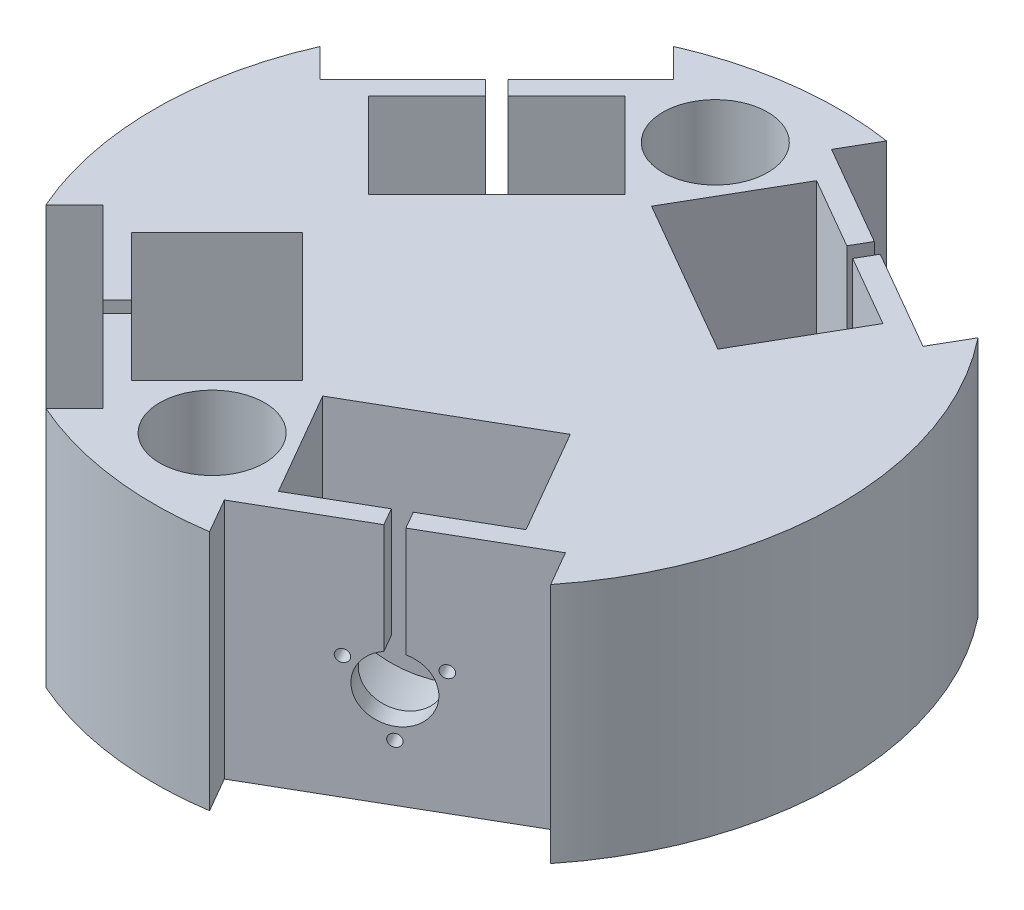
from build123d import *

# Parameters (mm, degrees)
BASE_DEPTH                = 60
MOTOR_TRASEIRO_START      = -5
MOTOR_TRASEIRO_DEPTH      = 30
ESBO_O3_10_R              = 1.5
MOTOR_EIXO_DEPTH          = 25
PADR_OCIRCULAR1_COUNT     = 2
PADR_OCIRCULAR1_ANGLE     = 285
ESPELHAR3_START           = -5
ESPELHAR3_COPY_1_DEPTH    = 30
ESPELHAR3_COPY_2_SKETCH_R = 1.5
ESPELHAR3_COPY_2_DEPTH    = 25
ESBO_O16_R                = 13
CAPACITORES_DEPTH         = 45


with BuildPart() as part:
    # Esboço1 → Base (new body)
    with BuildSketch(Plane(origin=(0, 0, 0), x_dir=(1, 0, 0), z_dir=(0, 1, 0))):
        with BuildLine():
            Line((-70.813516723, -26.97289629), (-26.97289629, -70.813516723))
            Line((-26.97289629, -70.813516723), (-34.043964102, -77.884584535))
            ThreePointArc((-34.043964102, -77.884584535), (-11.094726339, -84.272813217), (12.725930358, -84.041957953))
            Line((12.725930358, -84.041957953), (7.725930358, -75.381703915))
            Line((7.725930358, -75.381703915), (61.419505392, -44.381703915))
            Line((61.419505392, -44.381703915), (66.419505392, -53.041957953))
            ThreePointArc((66.419505392, -53.041957953), (85, 0), (66.419505392, 53.041957953))
            Line((66.419505392, 53.041957953), (61.419505392, 44.381703915))
            Line((61.419505392, 44.381703915), (7.725930358, 75.381703915))
            Line((7.725930358, 75.381703915), (12.725930358, 84.041957953))
            ThreePointArc((12.725930358, 84.041957953), (-11.094726339, 84.272813217), (-34.043964102, 77.884584535))
            Line((-34.043964102, 77.884584535), (-26.97289629, 70.813516723))
            Line((-26.97289629, 70.813516723), (-70.813516723, 26.97289629))
            Line((-70.813516723, 26.97289629), (-77.884584535, 34.043964102))
            ThreePointArc((-77.884584535, 34.043964102), (-85, 0), (-77.884584535, -34.043964102))
            Line((-77.884584535, -34.043964102), (-70.813516723, -26.97289629))
        make_face()
    extrude(amount=BASE_DEPTH)

    # Esboço3 → Motor-traseiro (cut)
    with BuildSketch(Plane(origin=(-48.893206507, 0, 48.893206507), x_dir=(0.7071067811865515, 0, 0.7071067811865436), z_dir=(-0.7071067811865436, 0, 0.7071067811865515)).offset(MOTOR_TRASEIRO_START)):
        with BuildLine():
            ThreePointArc((-22.5, 25), (0, 2.5), (22.5, 25))
            Line((22.5, 25), (22.5, 80))
            Line((22.5, 80), (-22.5, 80))
            Line((-22.5, 80), (-22.5, 25))
        make_face()
    motor_traseiro = extrude(amount=-MOTOR_TRASEIRO_DEPTH, mode=Mode.SUBTRACT)

    # Esboço3<10> → Motor-eixo (cut)
    with BuildSketch(Plane(origin=(-48.893206507, 0, 48.893206507), x_dir=(0.7071067811865515, 0, 0.7071067811865436), z_dir=(-0.7071067811865436, 0, 0.7071067811865515))):
        with BuildLine():
            Line((2, 32.745966692), (2, 70))
            Line((2, 70), (-2, 70))
            Line((-2, 70), (-2, 32.745966692))
            ThreePointArc((-2, 32.745966692), (0, 17), (2, 32.745966692))
        make_face()
        with Locations((0, 14)):
            Circle(ESBO_O3_10_R)
        with Locations((-9.526279442, 30.5)):
            Circle(ESBO_O3_10_R)
        with Locations((9.526279442, 30.5)):
            Circle(ESBO_O3_10_R)
    motor_eixo = extrude(amount=-MOTOR_EIXO_DEPTH, mode=Mode.SUBTRACT)

    # PadrãoCircular1: Motor-traseiro, Motor-eixo ×2 about axis
    padr_ocircular1_axis = Axis((0, 60, 0), (0, -1, 0))
    add([motor_traseiro.rotate(padr_ocircular1_axis, i * PADR_OCIRCULAR1_ANGLE / (PADR_OCIRCULAR1_COUNT - 1)) for i in range(1, PADR_OCIRCULAR1_COUNT)], mode=Mode.SUBTRACT)
    add([motor_eixo.rotate(padr_ocircular1_axis, i * PADR_OCIRCULAR1_ANGLE / (PADR_OCIRCULAR1_COUNT - 1)) for i in range(1, PADR_OCIRCULAR1_COUNT)], mode=Mode.SUBTRACT)

    # Espelhar3: Motor-traseiro, Motor-eixo across plane
    add(motor_traseiro.mirror(Plane.XY), mode=Mode.SUBTRACT)
    add(motor_eixo.mirror(Plane.XY), mode=Mode.SUBTRACT)

    # Espelhar3 copy 1 sketch → Espelhar3 copy 1 (cut)
    with BuildSketch(Plane(origin=(34.572717875, 0, -59.881703915), x_dir=(0.8660254037844427, 0, 0.499999999999993), z_dir=(0.499999999999993, 0, -0.8660254037844427)).offset(ESPELHAR3_START)):
        with BuildLine():
            ThreePointArc((-22.5, -25), (0, -2.5), (22.5, -25))
            Line((22.5, -25), (22.5, -80))
            Line((22.5, -80), (-22.5, -80))
            Line((-22.5, -80), (-22.5, -25))
        make_face()
    extrude(amount=-ESPELHAR3_COPY_1_DEPTH, mode=Mode.SUBTRACT)

    # Espelhar3 copy 2 sketch → Espelhar3 copy 2 (cut)
    with BuildSketch(Plane(origin=(34.572717875, 0, -59.881703915), x_dir=(0.8660254037844427, 0, 0.499999999999993), z_dir=(0.499999999999993, 0, -0.8660254037844427))):
        with BuildLine():
            Line((2, -32.745966692), (2, -70))
            Line((2, -70), (-2, -70))
            Line((-2, -70), (-2, -32.745966692))
            ThreePointArc((-2, -32.745966692), (0, -17), (2, -32.745966692))
        make_face()
        with Locations((0, -14)):
            Circle(ESPELHAR3_COPY_2_SKETCH_R)
        with Locations((-9.526279442, -30.5)):
            Circle(ESPELHAR3_COPY_2_SKETCH_R)
        with Locations((9.526279442, -30.5)):
            Circle(ESPELHAR3_COPY_2_SKETCH_R)
    extrude(amount=-ESPELHAR3_COPY_2_DEPTH, mode=Mode.SUBTRACT)

    # Esboço16 → Capacitores (cut)
    with BuildSketch(Plane(origin=(0, 60, 0), x_dir=(1, 0, 0), z_dir=(0, 1, 0))):
        with Locations(Location((-8.22315011, -62.461026267, 0), (0, 0, 270))):
            Circle(ESBO_O16_R)
        with Locations(Location((-8.22315011, 62.461026267, 0), (0, 0, 270))):
            Circle(ESBO_O16_R)
    extrude(amount=-CAPACITORES_DEPTH, mode=Mode.SUBTRACT)


solid = part.part
